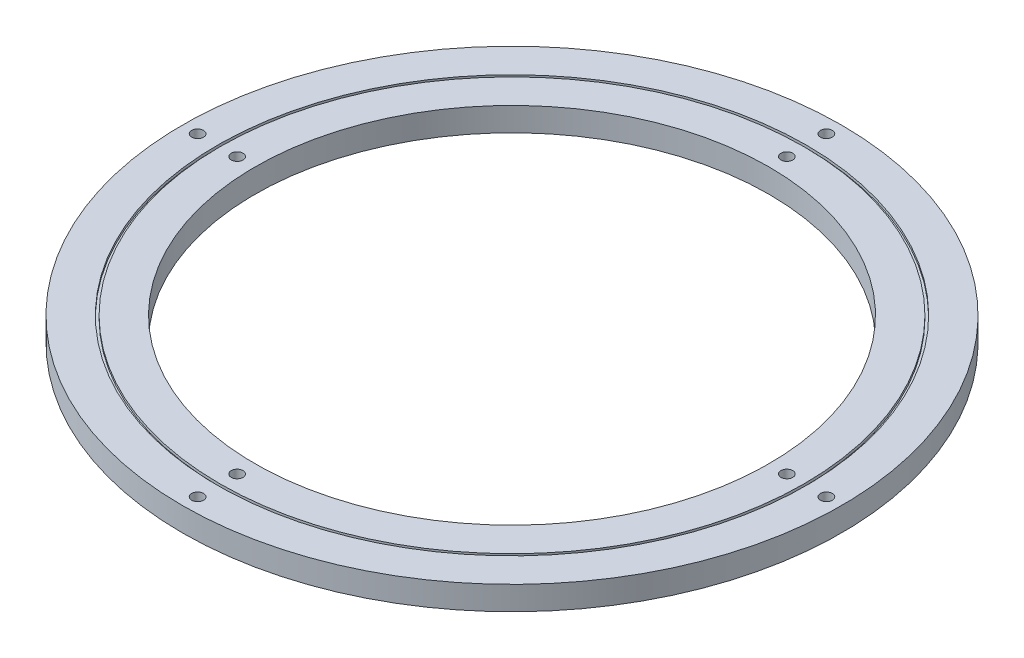
from build123d import *

# Parameters (mm, degrees)
CSK_FOR_M4_FLAT_HEAD_MACHINE_SCREW1_D           = 4.5
CSK_FOR_M4_FLAT_HEAD_MACHINE_SCREW1_CSINK_D     = 9.4
CSK_FOR_M4_FLAT_HEAD_MACHINE_SCREW1_CSINK_ANGLE = 90


with BuildPart() as part:
    # Sketch1 → Revolve1 (revolve)
    with BuildSketch(Plane.XY, mode=Mode.PRIVATE) as revolve1_sk:
        Polygon((-97.5, -4.5), (-97.5, 4.5), (-110.75, 4.5), (-110.75, 3.5), (-111.75, 3.5), (-111.75, 4.5), (-125, 4.5), (-125, -4.5), (-111.75, -4.5), (-111.75, -3.5), (-110.75, -3.5), (-110.75, -4.5), align=None)
    revolve(revolve1_sk.sketch.rotate(Axis((0, 0, 0), (0, 1, 0)), 270), axis=Axis((0, 0, 0), (0, 1, 0)))

    # CSK for M4 Flat Head Machine Screw1 (through all)
    with Locations(Plane(origin=(0, -4.5, 0), x_dir=(-1, 0, 0), z_dir=(0, -1, 0))):
        with Locations((-119.25, 0), (0, 104.25), (0, 119.25), (104.25, 0), (119.25, 0), (0, -104.25), (0, -119.25), (-104.25, 0)):
            CounterSinkHole(CSK_FOR_M4_FLAT_HEAD_MACHINE_SCREW1_D / 2, CSK_FOR_M4_FLAT_HEAD_MACHINE_SCREW1_CSINK_D / 2, counter_sink_angle=CSK_FOR_M4_FLAT_HEAD_MACHINE_SCREW1_CSINK_ANGLE)


solid = part.part
